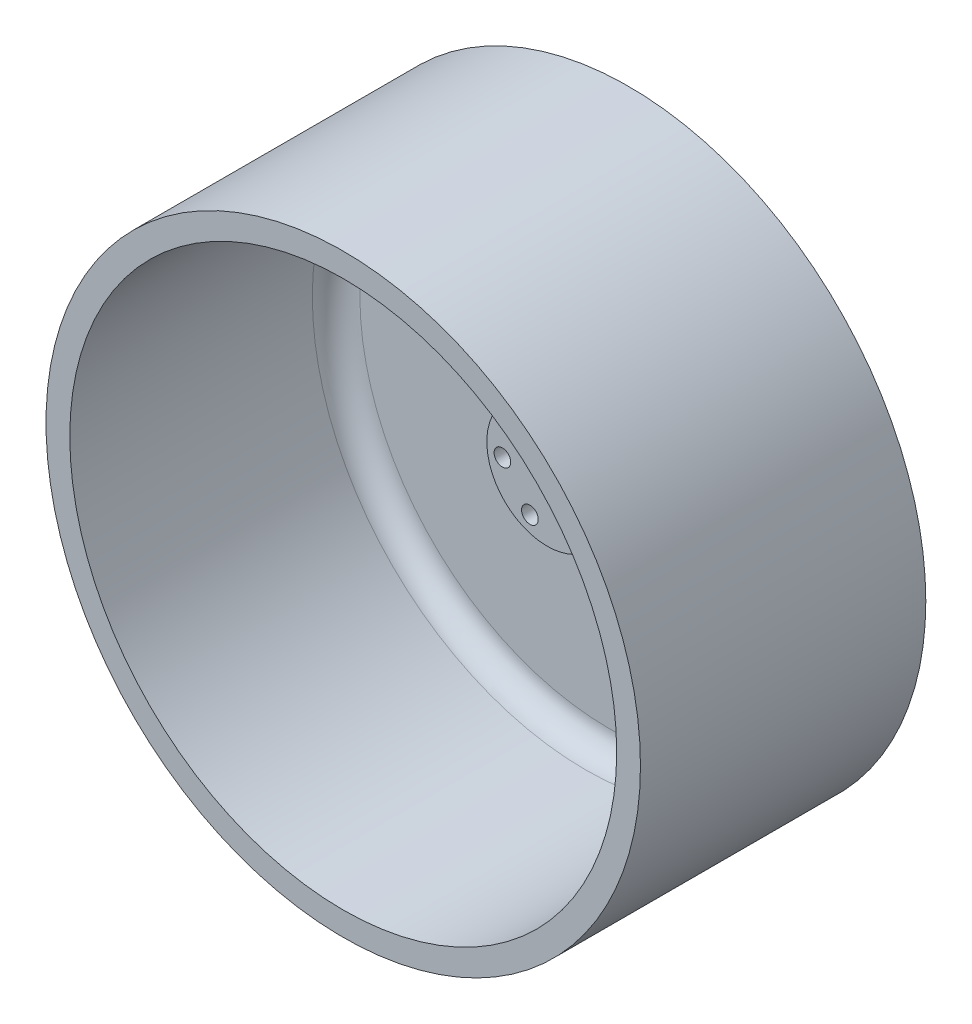
from build123d import *

# Parameters (mm, degrees)
SKETCH1_R           = 62.5
BOSS_EXTRUDE1_DEPTH = 60
SKETCH2_R           = 57.5
CUT_EXTRUDE1_DEPTH  = 56
SKETCH3_R           = 12.7
BOSS_EXTRUDE2_DEPTH = 13.11
SKETCH4_R           = 1.75
SKETCH4_R_2         = 3
CUT_EXTRUDE2_DEPTH  = 99.244857881
SKETCH5_R           = 3.25
CUT_EXTRUDE3_DEPTH  = 3
FILLET1_R           = 5
FILLET2_R           = 10


with BuildPart() as part:
    # Sketch1 → Boss-Extrude1 (new body)
    with BuildSketch(Plane.XY):
        Circle(SKETCH1_R)
    extrude(amount=BOSS_EXTRUDE1_DEPTH)

    # Sketch2 → Cut-Extrude1 (cut)
    with BuildSketch(Plane.XY.offset(60)):
        Circle(SKETCH2_R)
    extrude(amount=-CUT_EXTRUDE1_DEPTH, mode=Mode.SUBTRACT)

    # Sketch3 → Boss-Extrude2 (add)
    with BuildSketch(Plane.XY.offset(4)):
        Circle(SKETCH3_R)
    extrude(amount=BOSS_EXTRUDE2_DEPTH)

    # Sketch4 → Cut-Extrude2 (cut, through all)
    with BuildSketch(Plane.XY.offset(17.11)):
        with Locations((-5.784301124, 7.536037454)):
            Circle(SKETCH4_R)
        with Locations((-9.418550441, -1.24133299)):
            Circle(SKETCH4_R)
        with Locations((-3.634249317, -8.777370444)):
            Circle(SKETCH4_R)
        with Locations((5.784301124, -7.536037454)):
            Circle(SKETCH4_R)
        with Locations((9.418550441, 1.24133299)):
            Circle(SKETCH4_R)
        with Locations((3.634249317, 8.777370444)):
            Circle(SKETCH4_R)
        Circle(SKETCH4_R_2)
    extrude(amount=-CUT_EXTRUDE2_DEPTH, mode=Mode.SUBTRACT)

    # Sketch5 → Cut-Extrude3 (cut)
    with BuildSketch(Plane(origin=(0, 0, 0), x_dir=(-1, 0, 0), z_dir=(0, 0, -1))):
        with Locations((-9.418550441, 1.24133299)):
            Circle(SKETCH5_R)
        with Locations((-3.634249317, 8.777370444)):
            Circle(SKETCH5_R)
        with Locations((5.784301124, 7.536037454)):
            Circle(SKETCH5_R)
        with Locations((9.418550441, -1.24133299)):
            Circle(SKETCH5_R)
        with Locations((3.634249317, -8.777370444)):
            Circle(SKETCH5_R)
        with Locations((-5.784301124, -7.536037454)):
            Circle(SKETCH5_R)
    extrude(amount=-CUT_EXTRUDE3_DEPTH, mode=Mode.SUBTRACT)

    # Fillet1
    fillet1_edges = [part.edges().sort_by_distance(p)[0] for p in [
        (-57.5, 0, 4),
    ]]
    fillet(fillet1_edges, radius=FILLET1_R)

    # Fillet2
    fillet2_edges = [part.edges().sort_by_distance(p)[0] for p in [
        (-12.7, 0, 4),
    ]]
    fillet(fillet2_edges, radius=FILLET2_R)


solid = part.part
